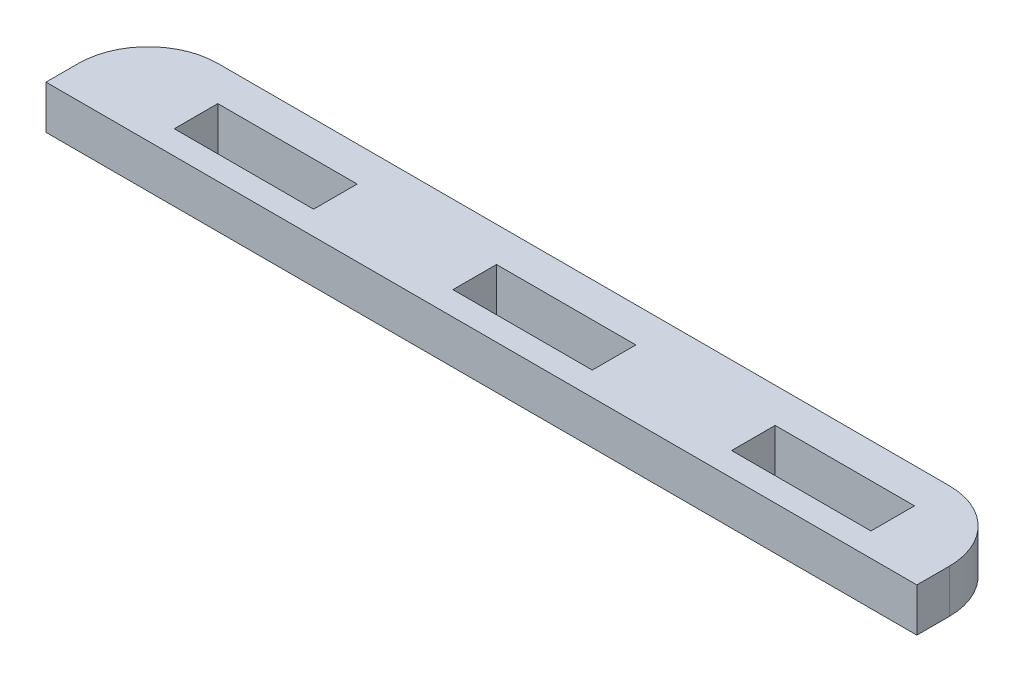
from build123d import *

# Parameters (mm, degrees)
SKETCH1_W            = 63.5
SKETCH1_H            = 33.401
SKETCH1_W_2          = 10.16
SKETCH1_H_2          = 3.175
SKETCH1_W_3          = 40.64
SKETCH1_H_3          = 20.066
MAIN_EXTRUSION_DEPTH = 3.175
SKETCH3_R            = 2.2225
MOUNTING_HOLES_DEPTH = 37.777630008
TAB_CUTOUT_DEPTH     = 37.777630008
FILLET1_R            = 5.08
SKETCH6_W            = 69.522251557
SKETCH6_H            = 29.320751893
CUT_EXTRUDE3_DEPTH   = 37.777630008


with BuildPart() as part:
    # Sketch1 → Main Extrusion (new body)
    with BuildSketch(Plane(origin=(0, 0, 0), x_dir=(1, 0, 0), z_dir=(0, 1, 0))):
        with Locations((0, 1.5875)):
            Rectangle(SKETCH1_W, SKETCH1_H)
        with Locations((21.59, 14.1605)):
            Rectangle(SKETCH1_W_2, SKETCH1_H_2, mode=Mode.SUBTRACT)
        with Locations((1.27, 14.1605)):
            Rectangle(SKETCH1_W_2, SKETCH1_H_2, mode=Mode.SUBTRACT)
        with Locations((-19.05, 14.1605)):
            Rectangle(SKETCH1_W_2, SKETCH1_H_2, mode=Mode.SUBTRACT)
        Rectangle(SKETCH1_W_3, SKETCH1_H_3, mode=Mode.SUBTRACT)
    extrude(amount=MAIN_EXTRUSION_DEPTH)

    # Sketch3 → Mounting Holes (cut, through all)
    with BuildSketch(Plane(origin=(0, 3.175, 0), x_dir=(1, 0, 0), z_dir=(0, 1, 0))):
        with Locations(Location((-24.992246486, 4.9657, 0), (0, 0, 270))):
            Circle(SKETCH3_R)
        with Locations(Location((-24.992246486, -4.9657, 0), (0, 0, 270))):
            Circle(SKETCH3_R)
        with Locations(Location((24.992246486, -4.9657, 0), (0, 0, 90))):
            Circle(SKETCH3_R)
        with Locations(Location((24.992246486, 4.9657, 0), (0, 0, 90))):
            Circle(SKETCH3_R)
    extrude(amount=-MOUNTING_HOLES_DEPTH, mode=Mode.SUBTRACT)

    # Sketch5 → Tab cutout (cut, through all)
    with BuildSketch(Plane(origin=(0, 3.175, 0), x_dir=(1, 0, 0), z_dir=(0, 1, 0))):
        Polygon((-20.32, 0), (-20.32, 0.889), (-27.305, 0.889), (-27.305, -0.889), (-20.32, -0.889), align=None)
        Polygon((27.305, -0.889), (20.32, -0.889), (20.32, 0), (20.32, 0.889), (27.305, 0.889), align=None)
    extrude(amount=-TAB_CUTOUT_DEPTH, mode=Mode.SUBTRACT)

    # Fillet1
    fillet1_edges = [part.edges().sort_by_distance(p)[0] for p in [
        (31.75, 1.5875, 15.113),
        (-31.75, 1.5875, 15.113),
        (-31.75, 1.5875, -18.288),
        (31.75, 1.5875, -18.288),
    ]]
    fillet(fillet1_edges, radius=FILLET1_R)

    # Sketch6 → Cut-Extrude3 (cut, through all)
    with BuildSketch(Plane(origin=(0, 3.175, 0), x_dir=(1, 0, 0), z_dir=(0, 1, 0))):
        with Locations((-0.129688159, -3.818782995)):
            Rectangle(SKETCH6_W, SKETCH6_H)
    extrude(amount=-CUT_EXTRUDE3_DEPTH, mode=Mode.SUBTRACT)


solid = part.part
